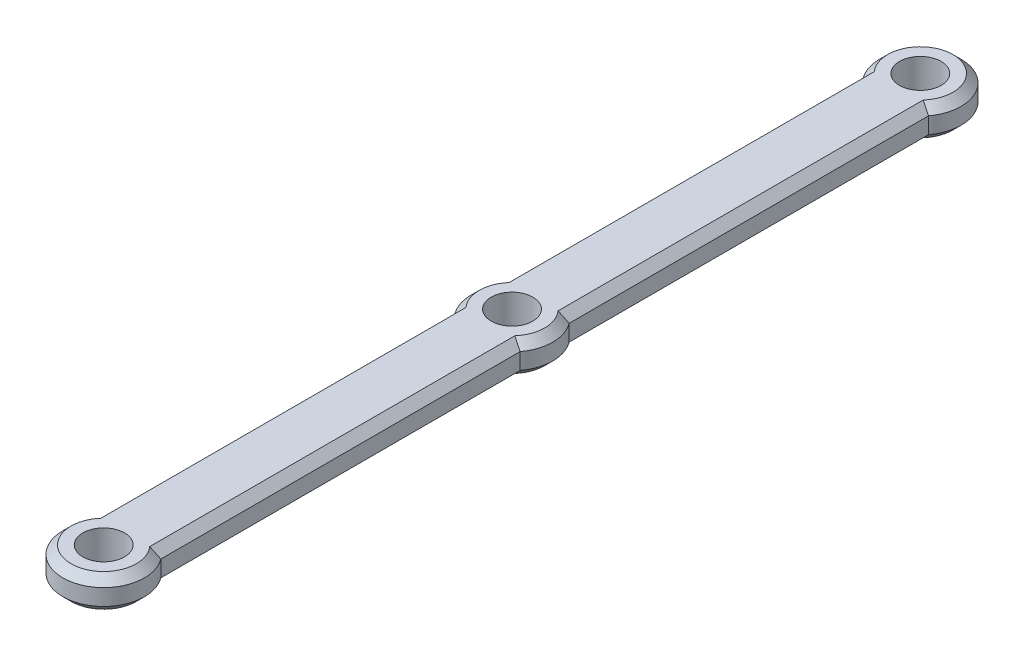
from build123d import *

# Parameters (mm, degrees)
EXTRUDE_1_DEPTH     = 4
SKETCH_2_R          = 2.55
CUT_EXTRUDE_1_DEPTH = 56.3714728
CHAMFER_1_SIZE      = 1


with BuildPart() as part:
    # 草图1 → 凸台-拉伸1 (new body)
    with BuildSketch(Plane(origin=(0, 0, 0), x_dir=(1, 0, 0), z_dir=(0, 1, 0))):
        with BuildLine():
            Line((-4, 47), (-4, 3))
            ThreePointArc((-4, 3), (-5, 0), (-4, -3))
            Line((-4, -3), (-4, -47))
            ThreePointArc((-4, -47), (0, -55), (4, -47))
            Line((4, -47), (4, -3))
            ThreePointArc((4, -3), (5, 0), (4, 3))
            Line((4, 3), (4, 47))
            ThreePointArc((4, 47), (0, 55), (-4, 47))
        make_face()
    extrude(amount=EXTRUDE_1_DEPTH)

    # 草图2 → 切除-拉伸1 (cut, through all)
    with BuildSketch(Plane(origin=(0, 4, 0), x_dir=(1, 0, 0), z_dir=(0, 1, 0))):
        with Locations(Location((0, 50, 0), (0, 0, 270))):
            Circle(SKETCH_2_R)
        with Locations(Location((0, -50, 0), (0, 0, 90))):
            Circle(SKETCH_2_R)
        with Locations(Location((0, 0, 0), (0, 0, 270))):
            Circle(SKETCH_2_R)
    extrude(amount=-CUT_EXTRUDE_1_DEPTH, mode=Mode.SUBTRACT)

    # 倒角1
    chamfer_1_edges = [part.edges().sort_by_distance(p)[0] for p in [
        (4, 0, 25),
        (0, 0, 55),
        (-4, 0, 25),
        (-5, 0, 0),
        (0, 4, 55),
        (4, 4, 25),
        (5, 4, 0),
        (4, 4, -25),
        (0, 4, -55),
        (-4, 4, -25),
        (-5, 4, 0),
        (-4, 0, -25),
        (-4, 4, 25),
        (0, 0, -55),
        (4, 0, -25),
        (5, 0, 0),
    ]]
    chamfer(chamfer_1_edges, length=CHAMFER_1_SIZE)


solid = part.part
